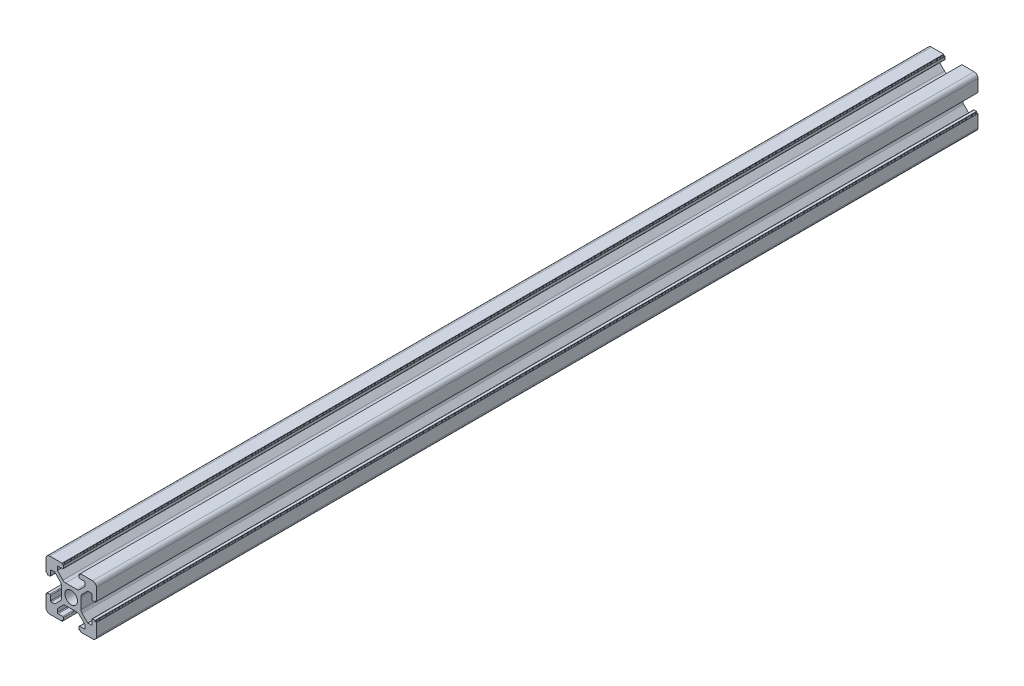
from build123d import *

# Parameters (mm, degrees)
SKETCH_1_R      = 2.5
EXTRUDE_1_DEPTH = 350


with BuildPart() as part:
    # 草图1 → 凸台-拉伸1 (new body)
    with BuildSketch(Plane.XY):
        with BuildLine():
            Line((4.215995631, 3.244230202), (6.436655803, 5.464890373))
            Line((6.436655803, 5.464890373), (7.776655803, 5.464890373))
            ThreePointArc((7.776655803, 5.464890373), (7.988787838, 5.377022408), (8.076655803, 5.164890373))
            Line((8.076655803, 5.164890373), (8.076655803, 3.364890373))
            ThreePointArc((8.076655803, 3.364890373), (8.164523769, 3.152758339), (8.376655803, 3.064890373))
            Line((8.376655803, 3.064890373), (9.376655803, 3.064890373))
            Line((9.376655803, 3.064890373), (9.376655803, 3.364890373))
            ThreePointArc((9.376655803, 3.364890373), (9.435234447, 3.50631173), (9.576655803, 3.564890373))
            Line((9.576655803, 3.564890373), (9.876655803, 3.564890373))
            Line((9.876655803, 3.564890373), (9.876655803, 8.464890373))
            ThreePointArc((9.876655803, 8.464890373), (9.437315975, 9.525550545), (8.376655803, 9.964890373))
            Line((8.376655803, 9.964890373), (3.476655803, 9.964890373))
            Line((3.476655803, 9.964890373), (3.476655803, 9.664890373))
            ThreePointArc((3.476655803, 9.664890373), (3.418077159, 9.523469017), (3.276655803, 9.464890373))
            Line((3.276655803, 9.464890373), (2.976655803, 9.464890373))
            Line((2.976655803, 9.464890373), (2.976655803, 8.464890373))
            ThreePointArc((2.976655803, 8.464890373), (3.064523769, 8.252758339), (3.276655803, 8.164890373))
            Line((3.276655803, 8.164890373), (5.076655803, 8.164890373))
            ThreePointArc((5.076655803, 8.164890373), (5.288787838, 8.077022408), (5.376655803, 7.864890373))
            Line((5.376655803, 7.864890373), (5.376655803, 6.524890373))
            Line((5.376655803, 6.524890373), (3.155995631, 4.304230202))
            ThreePointArc((3.155995631, 4.304230202), (2.669360608, 3.979071075), (2.09533546, 3.864890373))
            Line((2.09533546, 3.864890373), (-2.342023853, 3.864890373))
            ThreePointArc((-2.342023853, 3.864890373), (-2.916049002, 3.979071075), (-3.402684025, 4.304230202))
            Line((-3.402684025, 4.304230202), (-5.623344197, 6.524890373))
            Line((-5.623344197, 6.524890373), (-5.623344197, 7.864890373))
            ThreePointArc((-5.623344197, 7.864890373), (-5.535476231, 8.077022408), (-5.323344197, 8.164890373))
            Line((-5.323344197, 8.164890373), (-3.523344197, 8.164890373))
            ThreePointArc((-3.523344197, 8.164890373), (-3.311212162, 8.252758339), (-3.223344197, 8.464890373))
            Line((-3.223344197, 8.464890373), (-3.223344197, 9.464890373))
            Line((-3.223344197, 9.464890373), (-3.523344197, 9.464890373))
            ThreePointArc((-3.523344197, 9.464890373), (-3.664765553, 9.523469017), (-3.723344197, 9.664890373))
            Line((-3.723344197, 9.664890373), (-3.723344197, 9.964890373))
            Line((-3.723344197, 9.964890373), (-8.623344197, 9.964890373))
            ThreePointArc((-8.623344197, 9.964890373), (-9.684004369, 9.525550545), (-10.123344197, 8.464890373))
            Line((-10.123344197, 8.464890373), (-10.123344197, 3.564890373))
            Line((-10.123344197, 3.564890373), (-9.823344197, 3.564890373))
            ThreePointArc((-9.823344197, 3.564890373), (-9.681922841, 3.50631173), (-9.623344197, 3.364890373))
            Line((-9.623344197, 3.364890373), (-9.623344197, 3.064890373))
            Line((-9.623344197, 3.064890373), (-8.623344197, 3.064890373))
            ThreePointArc((-8.623344197, 3.064890373), (-8.411212162, 3.152758339), (-8.323344197, 3.364890373))
            Line((-8.323344197, 3.364890373), (-8.323344197, 5.164890373))
            ThreePointArc((-8.323344197, 5.164890373), (-8.235476231, 5.377022408), (-8.023344197, 5.464890373))
            Line((-8.023344197, 5.464890373), (-6.683344197, 5.464890373))
            Line((-6.683344197, 5.464890373), (-4.462684025, 3.244230202))
            ThreePointArc((-4.462684025, 3.244230202), (-4.137524898, 2.757595178), (-4.023344197, 2.18357003))
            Line((-4.023344197, 2.18357003), (-4.023344197, -2.253789283))
            ThreePointArc((-4.023344197, -2.253789283), (-4.137524898, -2.827814432), (-4.462684025, -3.314449455))
            Line((-4.462684025, -3.314449455), (-6.683344197, -5.535109627))
            Line((-6.683344197, -5.535109627), (-8.023344197, -5.535109627))
            ThreePointArc((-8.023344197, -5.535109627), (-8.235476231, -5.447241661), (-8.323344197, -5.235109627))
            Line((-8.323344197, -5.235109627), (-8.323344197, -3.435109627))
            ThreePointArc((-8.323344197, -3.435109627), (-8.411212162, -3.222977592), (-8.623344197, -3.135109627))
            Line((-8.623344197, -3.135109627), (-9.623344197, -3.135109627))
            Line((-9.623344197, -3.135109627), (-9.623344197, -3.435109627))
            ThreePointArc((-9.623344197, -3.435109627), (-9.681922841, -3.576530983), (-9.823344197, -3.635109627))
            Line((-9.823344197, -3.635109627), (-10.123344197, -3.635109627))
            Line((-10.123344197, -3.635109627), (-10.123344197, -8.535109627))
            ThreePointArc((-10.123344197, -8.535109627), (-9.684004369, -9.595769798), (-8.623344197, -10.035109627))
            Line((-8.623344197, -10.035109627), (-3.723344197, -10.035109627))
            Line((-3.723344197, -10.035109627), (-3.723344197, -9.735109627))
            ThreePointArc((-3.723344197, -9.735109627), (-3.664765553, -9.59368827), (-3.523344197, -9.535109627))
            Line((-3.523344197, -9.535109627), (-3.223344197, -9.535109627))
            Line((-3.223344197, -9.535109627), (-3.223344197, -8.535109627))
            ThreePointArc((-3.223344197, -8.535109627), (-3.311212162, -8.322977592), (-3.523344197, -8.235109627))
            Line((-3.523344197, -8.235109627), (-5.323344197, -8.235109627))
            ThreePointArc((-5.323344197, -8.235109627), (-5.535476231, -8.147241661), (-5.623344197, -7.935109627))
            Line((-5.623344197, -7.935109627), (-5.623344197, -6.595109627))
            Line((-5.623344197, -6.595109627), (-3.402684025, -4.374449455))
            ThreePointArc((-3.402684025, -4.374449455), (-2.916049002, -4.049290328), (-2.342023853, -3.935109627))
            Line((-2.342023853, -3.935109627), (2.09533546, -3.935109627))
            ThreePointArc((2.09533546, -3.935109627), (2.669360608, -4.049290328), (3.155995631, -4.374449455))
            Line((3.155995631, -4.374449455), (5.376655803, -6.595109627))
            Line((5.376655803, -6.595109627), (5.376655803, -7.935109627))
            ThreePointArc((5.376655803, -7.935109627), (5.288787838, -8.147241661), (5.076655803, -8.235109627))
            Line((5.076655803, -8.235109627), (3.276655803, -8.235109627))
            ThreePointArc((3.276655803, -8.235109627), (3.064523769, -8.322977592), (2.976655803, -8.535109627))
            Line((2.976655803, -8.535109627), (2.976655803, -9.535109627))
            Line((2.976655803, -9.535109627), (3.276655803, -9.535109627))
            ThreePointArc((3.276655803, -9.535109627), (3.418077159, -9.59368827), (3.476655803, -9.735109627))
            Line((3.476655803, -9.735109627), (3.476655803, -10.035109627))
            Line((3.476655803, -10.035109627), (8.376655803, -10.035109627))
            ThreePointArc((8.376655803, -10.035109627), (9.437315975, -9.595769798), (9.876655803, -8.535109627))
            Line((9.876655803, -8.535109627), (9.876655803, -3.635109627))
            Line((9.876655803, -3.635109627), (9.576655803, -3.635109627))
            ThreePointArc((9.576655803, -3.635109627), (9.435234447, -3.576530983), (9.376655803, -3.435109627))
            Line((9.376655803, -3.435109627), (9.376655803, -3.135109627))
            Line((9.376655803, -3.135109627), (8.376655803, -3.135109627))
            ThreePointArc((8.376655803, -3.135109627), (8.164523769, -3.222977592), (8.076655803, -3.435109627))
            Line((8.076655803, -3.435109627), (8.076655803, -5.235109627))
            ThreePointArc((8.076655803, -5.235109627), (7.988787838, -5.447241661), (7.776655803, -5.535109627))
            Line((7.776655803, -5.535109627), (6.436655803, -5.535109627))
            Line((6.436655803, -5.535109627), (4.215995631, -3.314449455))
            ThreePointArc((4.215995631, -3.314449455), (3.890836504, -2.827814432), (3.776655803, -2.253789283))
            Line((3.776655803, -2.253789283), (3.776655803, 2.18357003))
            ThreePointArc((3.776655803, 2.18357003), (3.890836504, 2.757595178), (4.215995631, 3.244230202))
        make_face()
        with Locations((-0.123344197, -0.035109627)):
            Circle(SKETCH_1_R, mode=Mode.SUBTRACT)
    extrude(amount=EXTRUDE_1_DEPTH)


solid = part.part
